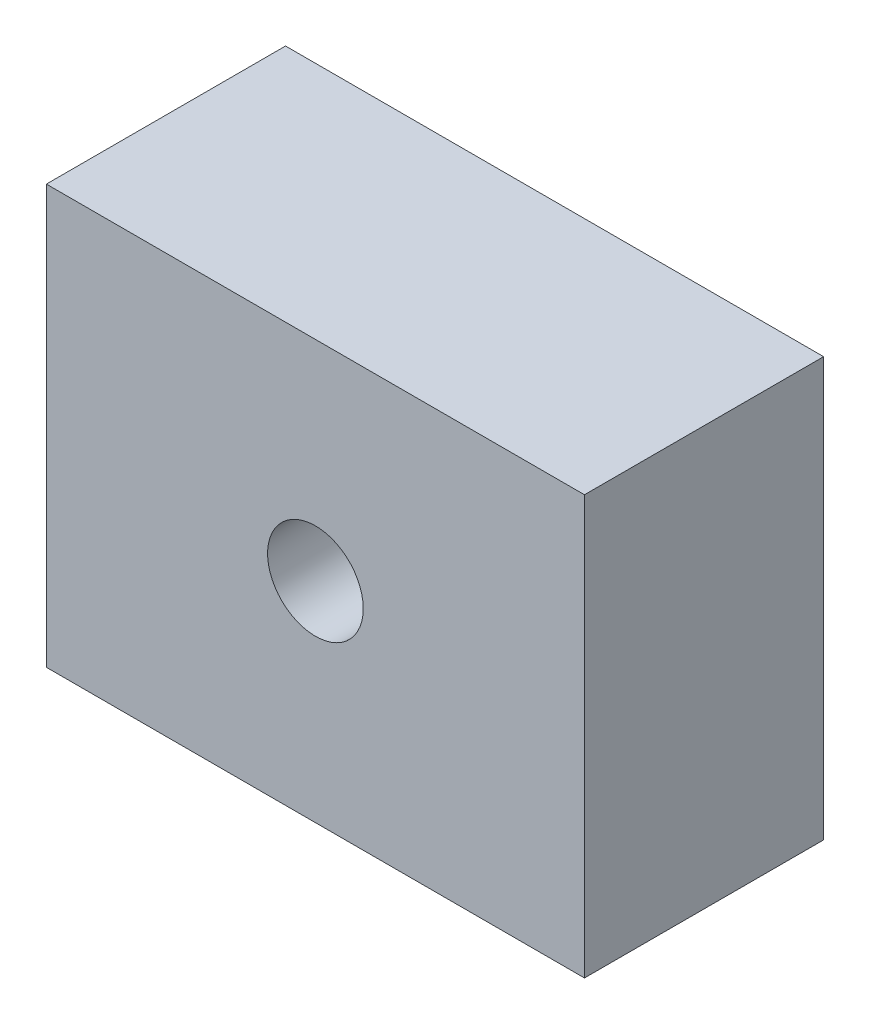
from build123d import *

# Parameters (mm, degrees)
SKETCH1_W           = 45
SKETCH1_H           = 35
BOSS_EXTRUDE1_DEPTH = 20
SKETCH2_R           = 4
CUT_EXTRUDE1_DEPTH  = 61.415229868


with BuildPart() as part:
    # Sketch1 → Boss-Extrude1 (new body)
    with BuildSketch(Plane.XY):
        with Locations((22.5, 17.5)):
            Rectangle(SKETCH1_W, SKETCH1_H)
    extrude(amount=BOSS_EXTRUDE1_DEPTH)

    # Sketch2 → Cut-Extrude1 (cut, through all)
    with BuildSketch(Plane.XY.offset(20)):
        with Locations((22.5, 17.5)):
            Circle(SKETCH2_R)
    extrude(amount=-CUT_EXTRUDE1_DEPTH, mode=Mode.SUBTRACT)


solid = part.part
